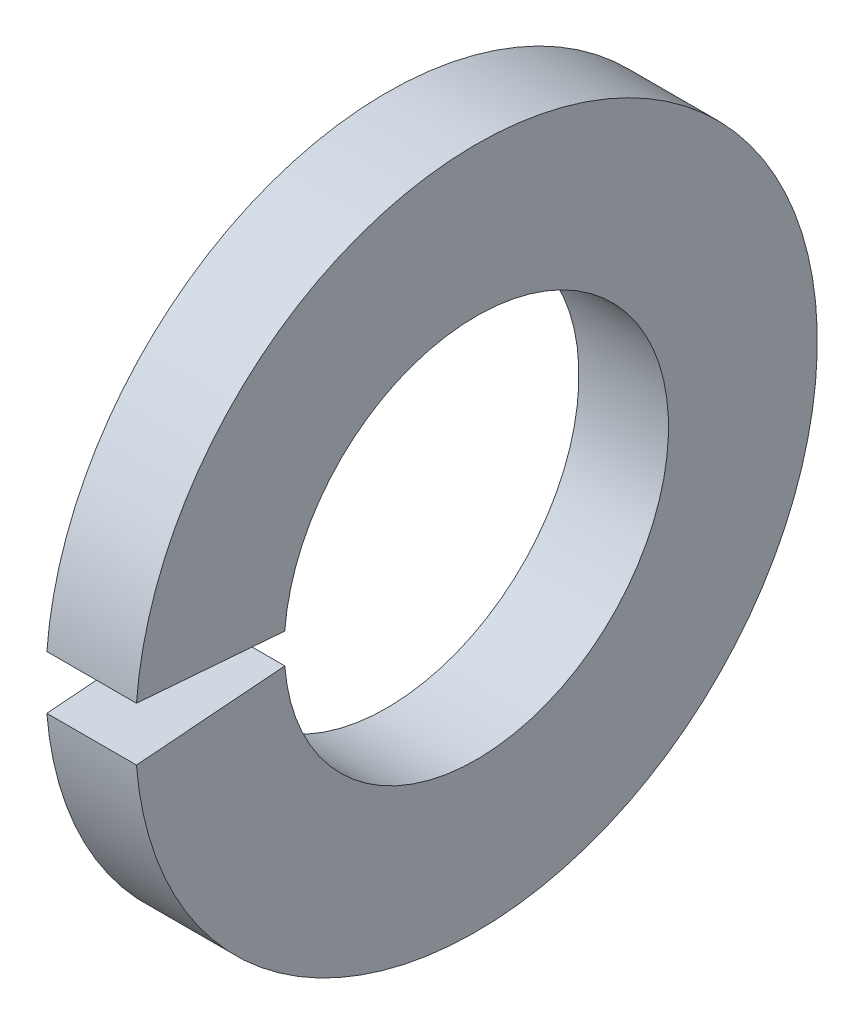
from build123d import *

# Parameters (mm, degrees)
SKETCH1_W = 0.7874
SKETCH1_H = 1.3081
GAP_DEPTH = 5.311196405


with BuildPart() as part:
    # Sketch1 → Base-Revolve (revolve)
    with BuildSketch(Plane.XY, mode=Mode.PRIVATE) as base_revolve_sk:
        with Locations((-0.3937, 2.34315)):
            Rectangle(SKETCH1_W, SKETCH1_H)
    revolve(base_revolve_sk.sketch.rotate(Axis((-34.925, 0, 0), (1, 0, 0)), 90), axis=Axis((-34.925, 0, 0), (1, 0, 0)))

    # Sketch2 → Gap (cut, through all)
    with BuildSketch(Plane(origin=(0, 0, 0), x_dir=(0, -1, 0), z_dir=(-1, 0, 0))):
        with BuildLine():
            Line((0, 0), (0.239860754, 3.047719845))
            ThreePointArc((0.239860754, 3.047719845), (0, 3.057144), (-0.239860754, 3.047719845))
            Line((-0.239860754, 3.047719845), (0, 0))
        make_face()
    extrude(amount=GAP_DEPTH, mode=Mode.SUBTRACT)


solid = part.part
